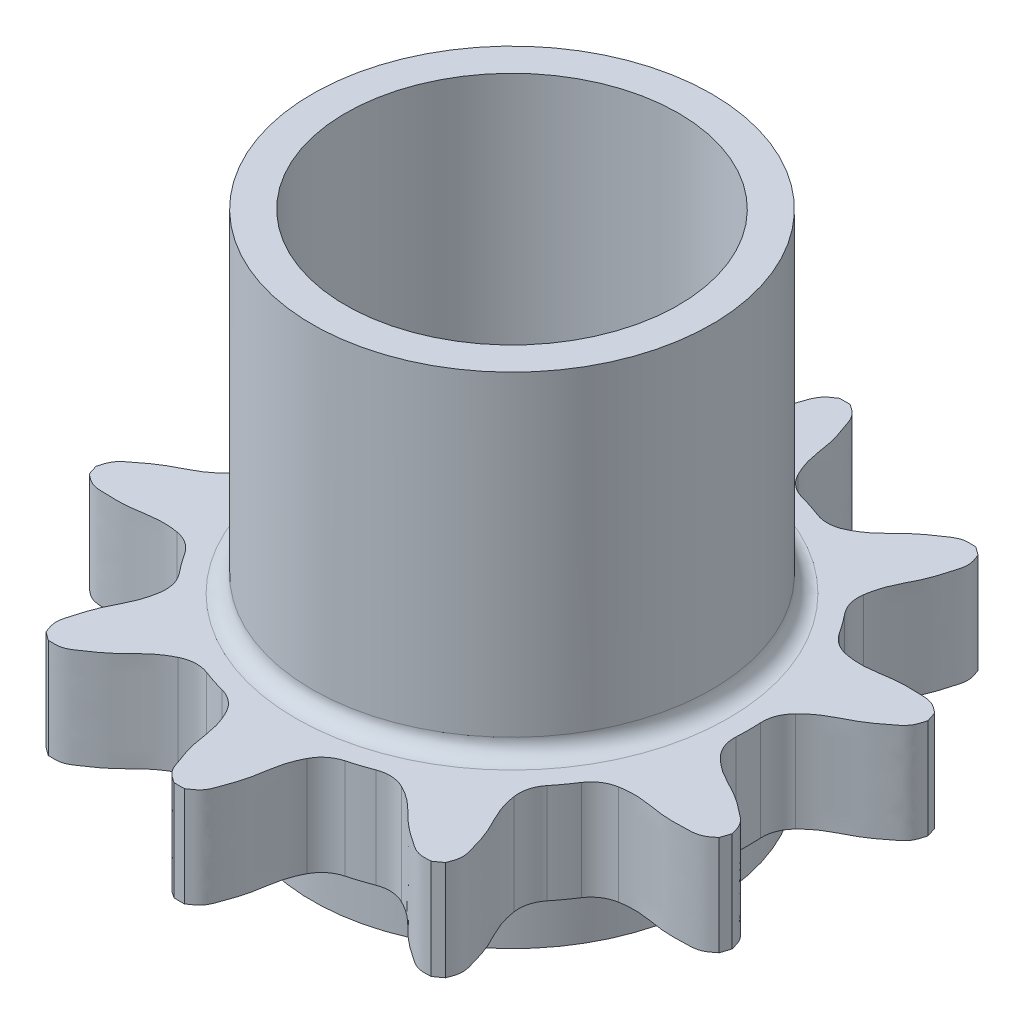
from build123d import *

# Parameters (mm, degrees)
SKETCH1_R           = 6
EXTRUDE1_DEPTH      = 3
EXTRUDE2_DEPTH      = 2
EXTRUDE2_DEPTH_BACK = 13
SKETCH2_R           = 6
SKETCH2_R_2         = 5
FILLET1_R           = 0.5


with BuildPart() as part:
    # Sketch1 → Extrude1 (new body)
    with BuildSketch(Plane(origin=(0, 0, 0), x_dir=(1, 0, 0), z_dir=(0, 1, 0))):
        with BuildLine():
            ThreePointArc((-3.351457327, -6.67757245), (-2.951630567, -6.571636357), (-2.543135475, -6.636564417))
            ThreePointArc((-2.543135475, -6.636564417), (-2.196228905, -6.75929759), (-1.843434846, -6.863910932))
            ThreePointArc((-1.843434846, -6.863910932), (-1.474791635, -7.051490405), (-1.21359267, -7.372206753))
            add(Edge.make_bspline(
                [(-0.156874883, -9.998769437), (-0.161518122, -9.995744209), (-0.263558893, -9.929341165), (-0.507246023, -9.7707477), (-0.666401432, -9.307170168), (-0.898700326, -8.66812572), (-0.941475619, -7.963232136), (-1.141309972, -7.512705109), (-1.21359267, -7.372206753)],
                knots=[-0.004716979, -0.004716979, -0.004716979, -0.004716979, 0.000118214, 0.105683219, 0.243126924, 0.421867192, 0.719006728, 0.859817339, 0.859817339, 0.859817339, 0.859817339], degree=3))
            ThreePointArc((-0.156874883, -9.998769437), (0, -10), (0.156874883, -9.998769437))
            add(Edge.make_bspline(
                [(0.156874883, -9.998769437), (0.161518122, -9.995744209), (0.263558893, -9.929341165), (0.507246024, -9.7707477), (0.666401431, -9.307170168), (0.89870033, -8.668125722), (0.941475598, -7.963232134), (1.141309985, -7.512705136), (1.213592675, -7.372206784)],
                knots=[-0.004716979, -0.004716979, -0.004716979, -0.004716979, 0.000118214, 0.10568322, 0.243126926, 0.421867196, 0.719006735, 0.859817339, 0.859817339, 0.859817339, 0.859817339], degree=3))
            ThreePointArc((1.213592675, -7.372206784), (1.474791645, -7.051490412), (1.843434873, -6.863910925))
            ThreePointArc((1.843434873, -6.863910925), (2.196228933, -6.759297581), (2.543135502, -6.636564408))
            ThreePointArc((2.543135502, -6.636564408), (2.951630572, -6.571636347), (3.351457313, -6.677572423))
            add(Edge.make_bspline(
                [(5.750214772, -8.18138314), (5.744680127, -8.181664906), (5.623096679, -8.187921773), (5.332730749, -8.202852671), (4.931487282, -7.921359768), (4.367932627, -7.540903816), (3.919000636, -6.99577561), (3.492518104, -6.74875128), (3.351457313, -6.677572423)],
                knots=[-0.004716979, -0.004716979, -0.004716979, -0.004716979, 0.000118215, 0.105683219, 0.243126924, 0.421867193, 0.719006729, 0.859817339, 0.859817339, 0.859817339, 0.859817339], degree=3))
            ThreePointArc((5.750214772, -8.18138314), (5.877852524, -8.090169944), (6.004043664, -7.996965655))
            add(Edge.make_bspline(
                [(6.004043664, -7.996965655), (6.006021938, -7.991788967), (6.049543912, -7.87808971), (6.153472063, -7.606549208), (6.009747445, -7.137957901), (5.822060306, -6.484418219), (5.442340169, -5.889004655), (5.339196457, -5.407060952), (5.315091524, -5.250908698)],
                knots=[-0.004716979, -0.004716979, -0.004716979, -0.004716979, 0.000118214, 0.10568322, 0.243126926, 0.421867196, 0.719006735, 0.859817339, 0.859817339, 0.859817339, 0.859817339], degree=3))
            ThreePointArc((5.315091524, -5.250908698), (5.337893576, -4.8379148), (5.525875757, -4.469476754))
            ThreePointArc((5.525875757, -4.469476754), (5.749801965, -4.177475636), (5.958314526, -3.874275848))
            ThreePointArc((5.958314526, -3.874275848), (6.250630223, -3.581640565), (6.636364515, -3.432332389))
            add(Edge.make_bspline(
                [(9.460917826, -3.238986558), (9.456605822, -3.242467694), (9.361920433, -3.318994554), (9.135785633, -3.501746729), (8.645715467, -3.509859173), (7.966163778, -3.53331296), (7.282551847, -3.356170579), (6.792322974, -3.407003842), (6.636364515, -3.432332389)],
                knots=[-0.004716979, -0.004716979, -0.004716979, -0.004716979, 0.000118215, 0.105683219, 0.243126925, 0.421867193, 0.719006729, 0.859817339, 0.859817339, 0.859817339, 0.859817339], degree=3))
            ThreePointArc((9.460917826, -3.238986558), (9.510565165, -3.090169943), (9.557871836, -2.940592799))
            add(Edge.make_bspline(
                [(9.557871836, -2.940592799), (9.556429512, -2.935241969), (9.524808769, -2.817675768), (9.449280926, -2.536907447), (9.057574197, -2.24228833), (8.52159113, -1.823883352), (7.864415772, -1.565377557), (7.497691357, -1.236103264), (7.386406065, -1.123941961)],
                knots=[-0.004716979, -0.004716979, -0.004716979, -0.004716979, 0.000118214, 0.10568322, 0.243126926, 0.421867197, 0.719006736, 0.859817339, 0.859817339, 0.859817339, 0.859817339], degree=3))
            ThreePointArc((7.386406065, -1.123941961), (7.16210159, -0.776420168), (7.097619919, -0.367854374))
            ThreePointArc((7.097619919, -0.367854374), (7.107146076, 1.5e-08), (7.097619917, 0.367854405))
            ThreePointArc((7.097619917, 0.367854405), (7.162101581, 0.776420177), (7.386406034, 1.123941957))
            add(Edge.make_bspline(
                [(9.557871836, 2.940592801), (9.556429512, 2.935241971), (9.524808768, 2.817675768), (9.449280927, 2.536907447), (9.057574197, 2.242288329), (8.521591128, 1.823883354), (7.864415777, 1.565377541), (7.497691331, 1.236103265), (7.386406034, 1.123941957)],
                knots=[-0.004716979, -0.004716979, -0.004716979, -0.004716979, 0.000118215, 0.10568322, 0.243126925, 0.421867193, 0.719006729, 0.859817339, 0.859817339, 0.859817339, 0.859817339], degree=3))
            ThreePointArc((9.557871836, 2.940592801), (9.510565166, 3.090169945), (9.460917827, 3.23898656))
            add(Edge.make_bspline(
                [(9.460917827, 3.23898656), (9.456605823, 3.242467696), (9.36192042, 3.318994538), (9.13578564, 3.501746739), (8.645715464, 3.509859168), (7.96616378, 3.533312966), (7.282551853, 3.356170562), (6.792322996, 3.407003859), (6.636364544, 3.432332405)],
                knots=[-0.004716979, -0.004716979, -0.004716979, -0.004716979, 0.000118215, 0.10568322, 0.243126927, 0.421867197, 0.719006736, 0.859817339, 0.859817339, 0.859817339, 0.859817339], degree=3))
            ThreePointArc((6.636364544, 3.432332405), (6.250630227, 3.581640579), (5.958314511, 3.874275874))
            ThreePointArc((5.958314511, 3.874275874), (5.74980195, 4.177475662), (5.52587574, 4.469476779))
            ThreePointArc((5.52587574, 4.469476779), (5.337893566, 4.837914802), (5.315091503, 5.250908678))
            add(Edge.make_bspline(
                [(6.004043665, 7.996965658), (6.00602194, 7.991788969), (6.049543887, 7.878089701), (6.153472077, 7.606549214), (6.00974744, 7.137957898), (5.822060305, 6.484418221), (5.44234018, 5.889004645), (5.339196438, 5.407060939), (5.315091503, 5.250908678)],
                knots=[-0.004716979, -0.004716979, -0.004716979, -0.004716979, 0.000118215, 0.105683219, 0.243126925, 0.421867193, 0.719006729, 0.859817339, 0.859817339, 0.859817339, 0.859817339], degree=3))
            ThreePointArc((6.004043665, 7.996965658), (5.877852526, 8.090169946), (5.750214773, 8.181383143))
            add(Edge.make_bspline(
                [(5.750214773, 8.181383143), (5.744680128, 8.181664909), (5.623096678, 8.187921744), (5.33273075, 8.202852688), (4.931487282, 7.921359761), (4.367932625, 7.540903823), (3.919000651, 6.9957756), (3.492518113, 6.748751307), (3.351457329, 6.677572453)],
                knots=[-0.004716979, -0.004716979, -0.004716979, -0.004716979, 0.000118215, 0.105683221, 0.243126927, 0.421867197, 0.719006736, 0.859817339, 0.859817339, 0.859817339, 0.859817339], degree=3))
            ThreePointArc((3.351457329, 6.677572453), (2.951630569, 6.571636361), (2.543135477, 6.636564421))
            ThreePointArc((2.543135477, 6.636564421), (2.196228907, 6.759297593), (1.843434848, 6.863910935))
            ThreePointArc((1.843434848, 6.863910935), (1.474791637, 7.051490408), (1.213592672, 7.372206756))
            add(Edge.make_bspline(
                [(0.156874885, 9.998769441), (0.161518124, 9.995744212), (0.263558868, 9.929341127), (0.507246038, 9.770747723), (0.666401426, 9.307170159), (0.89870033, 8.668125725), (0.941475612, 7.963232133), (1.141309978, 7.512705114), (1.213592672, 7.372206756)],
                knots=[-0.004716979, -0.004716979, -0.004716979, -0.004716979, 0.000118214, 0.105683219, 0.243126924, 0.421867193, 0.719006729, 0.859817339, 0.859817339, 0.859817339, 0.859817339], degree=3))
            ThreePointArc((0.156874885, 9.998769441), (2e-09, 10.000000003), (-0.156874881, 9.998769441))
            add(Edge.make_bspline(
                [(-0.156874881, 9.998769441), (-0.161518121, 9.995744212), (-0.263558879, 9.929341147), (-0.507246031, 9.770747711), (-0.666401428, 9.307170163), (-0.898700331, 8.668125724), (-0.9414756, 7.963232136), (-1.141309982, 7.512705138), (-1.213592673, 7.372206788)],
                knots=[-0.004716979, -0.004716979, -0.004716979, -0.004716979, 0.000118215, 0.105683221, 0.243126927, 0.421867198, 0.719006736, 0.859817339, 0.859817339, 0.859817339, 0.859817339], degree=3))
            ThreePointArc((-1.213592673, 7.372206788), (-1.474791643, 7.051490416), (-1.843434871, 6.863910929))
            ThreePointArc((-1.843434871, 6.863910929), (-2.196228931, 6.759297585), (-2.5431355, 6.636564411))
            ThreePointArc((-2.5431355, 6.636564411), (-2.95163057, 6.571636351), (-3.351457311, 6.677572427))
            add(Edge.make_bspline(
                [(-5.75021477, 8.181383144), (-5.744680126, 8.18166491), (-5.623096676, 8.187921733), (-5.33273075, 8.202852694), (-4.931487282, 7.921359759), (-4.367932627, 7.540903821), (-3.919000638, 6.995775605), (-3.492518102, 6.748751284), (-3.351457311, 6.677572427)],
                knots=[-0.004716979, -0.004716979, -0.004716979, -0.004716979, 0.000118214, 0.105683219, 0.243126924, 0.421867192, 0.719006729, 0.859817339, 0.859817339, 0.859817339, 0.859817339], degree=3))
            ThreePointArc((-5.75021477, 8.181383144), (-5.877852522, 8.090169947), (-6.004043662, 7.996965659))
            add(Edge.make_bspline(
                [(-6.004043662, 7.996965659), (-6.006021937, 7.991788969), (-6.049543917, 7.878089714), (-6.15347206, 7.606549207), (-6.009747446, 7.137957901), (-5.822060305, 6.484418219), (-5.442340172, 5.889004655), (-5.339196455, 5.407060955), (-5.315091522, 5.250908702)],
                knots=[-0.004716979, -0.004716979, -0.004716979, -0.004716979, 0.000118215, 0.105683221, 0.243126927, 0.421867198, 0.719006736, 0.859817339, 0.859817339, 0.859817339, 0.859817339], degree=3))
            ThreePointArc((-5.315091522, 5.250908702), (-5.337893574, 4.837914804), (-5.525875755, 4.469476758))
            ThreePointArc((-5.525875755, 4.469476758), (-5.749801963, 4.17747564), (-5.958314524, 3.874275852))
            ThreePointArc((-5.958314524, 3.874275852), (-6.250630221, 3.581640569), (-6.636364513, 3.432332393))
            add(Edge.make_bspline(
                [(-9.460917824, 3.238986562), (-9.456605821, 3.242467697), (-9.36192042, 3.318994541), (-9.13578564, 3.501746737), (-8.645715464, 3.509859169), (-7.966163779, 3.533312962), (-7.282551846, 3.356170575), (-6.792322973, 3.407003846), (-6.636364513, 3.432332393)],
                knots=[-0.004716979, -0.004716979, -0.004716979, -0.004716979, 0.000118214, 0.105683218, 0.243126924, 0.421867192, 0.719006728, 0.859817339, 0.859817339, 0.859817339, 0.859817339], degree=3))
            ThreePointArc((-9.460917824, 3.238986562), (-9.510565163, 3.090169947), (-9.557871834, 2.940592803))
            add(Edge.make_bspline(
                [(-9.557871834, 2.940592803), (-9.556429509, 2.935241972), (-9.524808799, 2.817675761), (-9.449280908, 2.536907452), (-9.057574204, 2.242288328), (-8.521591126, 1.823883353), (-7.864415776, 1.565377554), (-7.497691355, 1.236103267), (-7.386406063, 1.123941964)],
                knots=[-0.004716979, -0.004716979, -0.004716979, -0.004716979, 0.000118215, 0.105683221, 0.243126927, 0.421867197, 0.719006736, 0.859817339, 0.859817339, 0.859817339, 0.859817339], degree=3))
            ThreePointArc((-7.386406063, 1.123941964), (-7.162101588, 0.776420172), (-7.097619917, 0.367854378))
            ThreePointArc((-7.097619917, 0.367854378), (-7.107146074, -1.1e-08), (-7.097619915, -0.367854401))
            ThreePointArc((-7.097619915, -0.367854401), (-7.162101579, -0.776420173), (-7.386406032, -1.123941953))
            add(Edge.make_bspline(
                [(-9.557871834, -2.940592797), (-9.556429511, -2.935241968), (-9.524808777, -2.817675764), (-9.449280921, -2.536907449), (-9.0575742, -2.242288329), (-8.521591127, -1.823883355), (-7.864415775, -1.565377542), (-7.49769133, -1.236103262), (-7.386406032, -1.123941953)],
                knots=[-0.004716979, -0.004716979, -0.004716979, -0.004716979, 0.000118214, 0.105683218, 0.243126923, 0.421867192, 0.719006728, 0.859817339, 0.859817339, 0.859817339, 0.859817339], degree=3))
            ThreePointArc((-9.557871834, -2.940592797), (-9.510565164, -3.090169941), (-9.460917825, -3.238986556))
            add(Edge.make_bspline(
                [(-9.460917825, -3.238986556), (-9.456605821, -3.242467692), (-9.361920449, -3.318994574), (-9.135785623, -3.501746718), (-8.645715471, -3.509859177), (-7.966163776, -3.533312961), (-7.282551854, -3.356170567), (-6.792322994, -3.407003855), (-6.636364542, -3.432332401)],
                knots=[-0.004716979, -0.004716979, -0.004716979, -0.004716979, 0.000118215, 0.10568322, 0.243126927, 0.421867197, 0.719006736, 0.859817339, 0.859817339, 0.859817339, 0.859817339], degree=3))
            ThreePointArc((-6.636364542, -3.432332401), (-6.250630225, -3.581640575), (-5.958314509, -3.87427587))
            ThreePointArc((-5.958314509, -3.87427587), (-5.749801948, -4.177475658), (-5.525875738, -4.469476775))
            ThreePointArc((-5.525875738, -4.469476775), (-5.337893564, -4.837914799), (-5.315091501, -5.250908674))
            add(Edge.make_bspline(
                [(-6.004043663, -7.996965654), (-6.006021938, -7.991788966), (-6.04954392, -7.878089713), (-6.153472058, -7.606549207), (-6.009747447, -7.137957901), (-5.822060301, -6.484418219), (-5.442340181, -5.889004644), (-5.339196436, -5.407060936), (-5.315091501, -5.250908674)],
                knots=[-0.004716979, -0.004716979, -0.004716979, -0.004716979, 0.000118214, 0.105683218, 0.243126924, 0.421867192, 0.719006728, 0.859817339, 0.859817339, 0.859817339, 0.859817339], degree=3))
            ThreePointArc((-6.004043663, -7.996965654), (-5.877852524, -8.090169942), (-5.750214771, -8.181383139))
            add(Edge.make_bspline(
                [(-5.750214771, -8.181383139), (-5.744680127, -8.181664905), (-5.62309668, -8.187921786), (-5.332730748, -8.202852663), (-4.931487283, -7.921359771), (-4.367932625, -7.540903817), (-3.919000649, -6.995775602), (-3.492518112, -6.748751304), (-3.351457327, -6.67757245)],
                knots=[-0.004716979, -0.004716979, -0.004716979, -0.004716979, 0.000118215, 0.10568322, 0.243126927, 0.421867197, 0.719006735, 0.859817339, 0.859817339, 0.859817339, 0.859817339], degree=3))
        make_face()
        with Locations(Location((0, 0, 0), (0, 0, 270))):
            Circle(SKETCH1_R, mode=Mode.SUBTRACT)
    extrude(amount=-EXTRUDE1_DEPTH)

    # Sketch2 → Extrude2 (add, two sides: drawn at the far end of the back side and taken through both)
    with BuildSketch(Plane.XZ.offset(3).offset(-EXTRUDE2_DEPTH_BACK)):
        with Locations(Location((0, 0, 0), (0, 0, 270))):
            Circle(SKETCH2_R)
        with Locations(Location((0, 0, 0), (0, 0, 270))):
            Circle(SKETCH2_R_2, mode=Mode.SUBTRACT)
    extrude(amount=EXTRUDE2_DEPTH + EXTRUDE2_DEPTH_BACK)

    # Fillet1
    fillet1_edges = [part.edges().sort_by_distance(p)[0] for p in [
        (0, -3, 6),
        (0, 0, 6),
    ]]
    fillet(fillet1_edges, radius=FILLET1_R)


solid = part.part
